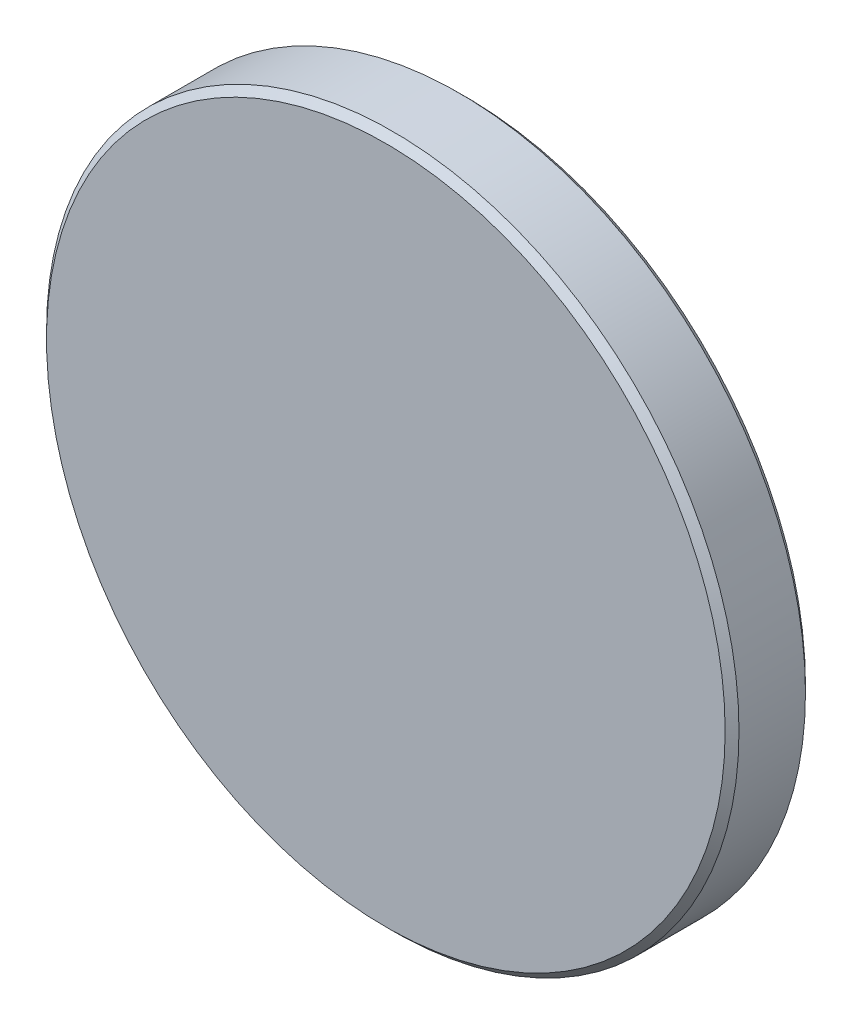
from build123d import *

# Parameters (mm, degrees)
ESQUISSE1_R        = 12.5
BOSS_EXTRU_2_DEPTH = 2.9
CHANFREIN2_SIZE    = 0.25
CHANFREIN3_SIZE    = 0.25


with BuildPart() as part:
    # Esquisse1 → Boss.-Extru.2 (new body)
    with BuildSketch(Plane.XY):
        Circle(ESQUISSE1_R)
    extrude(amount=BOSS_EXTRU_2_DEPTH)

    # Chanfrein2
    chanfrein2_edges = [part.edges().sort_by_distance(p)[0] for p in [
        (-12.5, 0, 2.9),
    ]]
    chamfer(chanfrein2_edges, length=CHANFREIN2_SIZE)

    # Chanfrein3
    chanfrein3_edges = [part.edges().sort_by_distance(p)[0] for p in [
        (-12.5, 0, 0),
    ]]
    chamfer(chanfrein3_edges, length=CHANFREIN3_SIZE)


solid = part.part
